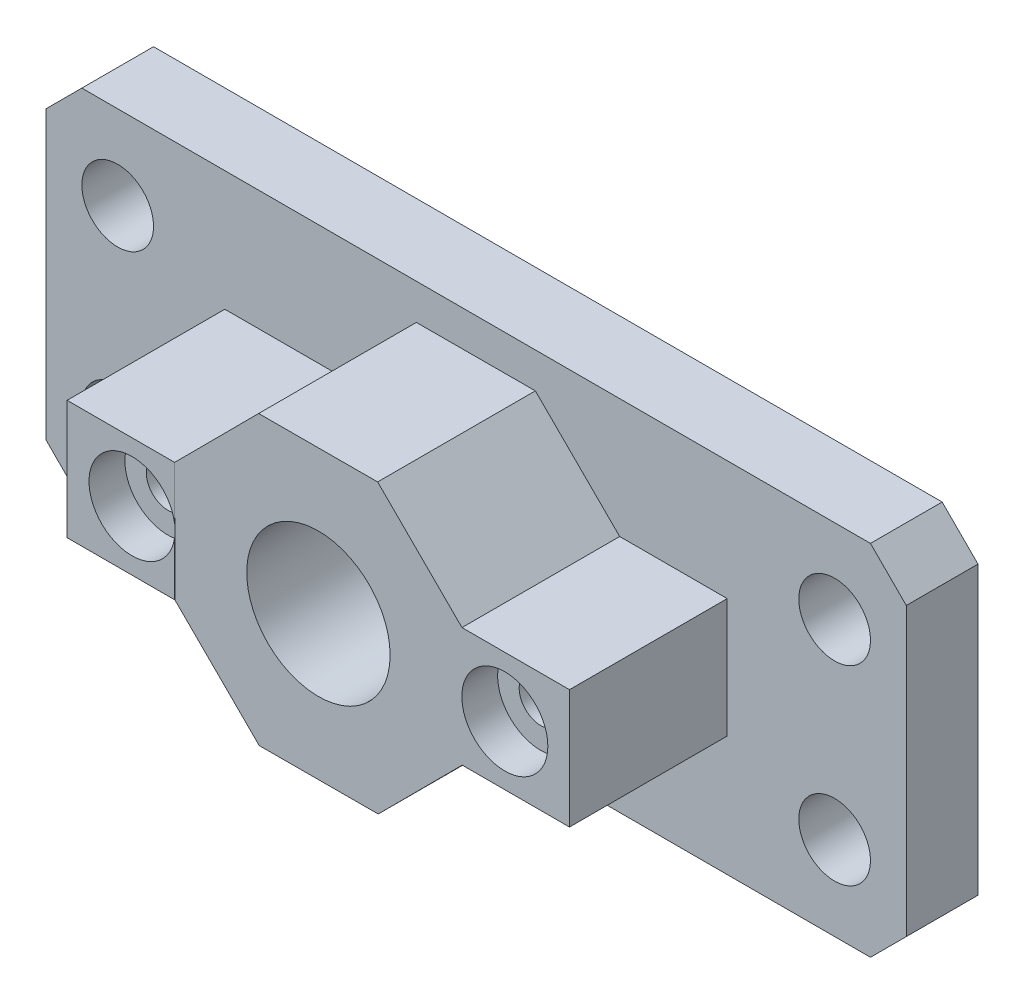
from build123d import *

# Parameters (mm, degrees)
SKETCH_1_W                 = 120
SKETCH_1_H                 = 50
EXTRUDE_1_DEPTH            = 10
CUT_EXTRUDE_START          = 10
SKETCH_1_4_R               = 5
CUT_EXTRUDE_1_DEPTH        = 76.76473219
SKETCH_1_5_R               = 5
CUT_EXTRUDE_2_DEPTH        = 76.76473219
SKETCH_1_6_R               = 5
CUT_EXTRUDE_3_DEPTH        = 76.76473219
SKETCH_1_7_R               = 5
CUT_EXTRUDE_4_DEPTH        = 76.76473219
EXTRUDE_START              = 10
EXTRUDE_2_DEPTH            = 22
SKETCH_1_9_W               = 15
SKETCH_1_9_H               = 16.6
EXTRUDE_7_DEPTH            = 22
SKETCH_1_10_W              = 15
SKETCH_1_10_H              = 16.6
EXTRUDE_8_DEPTH            = 22
CUT_EXTRUDE_START_2        = 32
SKETCH_1_11_R              = 10
CUT_EXTRUDE_5_DEPTH        = 22
HOLE_WIZARD_M52_AT_2_COUNT = 2
HOLE_WIZARD_M52_AT_2_PITCH = 52
CHAMFER_4_SIZE             = 5


with BuildPart() as part:
    # Эскиз1 → Бобышка-Вытянуть1 (new body)
    with BuildSketch(Plane.XY):
        Rectangle(SKETCH_1_W, SKETCH_1_H)
    extrude(amount=EXTRUDE_1_DEPTH)

    # Эскиз1<4> → Вырез-Вытянуть1 (cut, through all)
    with BuildSketch(Plane.XY.offset(CUT_EXTRUDE_START)):
        with Locations(Location((-50, 13.3, 0), (0, 0, 180))):
            Circle(SKETCH_1_4_R)
    extrude(amount=-CUT_EXTRUDE_1_DEPTH, mode=Mode.SUBTRACT)

    # Эскиз1<5> → Вырез-Вытянуть2 (cut, through all)
    with BuildSketch(Plane.XY.offset(CUT_EXTRUDE_START)):
        with Locations(Location((-50, -13.3, 0), (0, 0, 180))):
            Circle(SKETCH_1_5_R)
    extrude(amount=-CUT_EXTRUDE_2_DEPTH, mode=Mode.SUBTRACT)

    # Эскиз1<6> → Вырез-Вытянуть3 (cut, through all)
    with BuildSketch(Plane.XY.offset(CUT_EXTRUDE_START)):
        with Locations(Location((50, 13.3, 0), (0, 0, 180))):
            Circle(SKETCH_1_6_R)
    extrude(amount=-CUT_EXTRUDE_3_DEPTH, mode=Mode.SUBTRACT)

    # Эскиз1<7> → Вырез-Вытянуть4 (cut, through all)
    with BuildSketch(Plane.XY.offset(CUT_EXTRUDE_START)):
        with Locations(Location((50, -13.3, 0), (0, 0, 180))):
            Circle(SKETCH_1_7_R)
    extrude(amount=-CUT_EXTRUDE_4_DEPTH, mode=Mode.SUBTRACT)

    # Эскиз1<8> → Бобышка-Вытянуть2 (add)
    with BuildSketch(Plane.XY.offset(EXTRUDE_START)):
        Polygon((20.055336508, -8.258079739), (20.020608627, 8.341920261), (8.258079739, 20.055336508), (-8.341920261, 20.020608627), (-20.055336508, 8.258079739), (-20.020608627, -8.341920261), (-8.258079739, -20.055336508), (8.341920261, -20.020608627), align=None)
    extrude(amount=EXTRUDE_2_DEPTH)

    # Эскиз1<10> → Бобышка-Вытянуть8 (add)
    with BuildSketch(Plane.XY.offset(EXTRUDE_START)):
        with Locations((27.520608627, 0.041920261)):
            Rectangle(SKETCH_1_10_W, SKETCH_1_10_H)
    extrude(amount=EXTRUDE_8_DEPTH)

    # Эскиз1<11> → Вырез-Вытянуть5 (cut)
    with BuildSketch(Plane.XY.offset(CUT_EXTRUDE_START_2)):
        Circle(SKETCH_1_11_R)
    extrude(amount=-CUT_EXTRUDE_5_DEPTH, mode=Mode.SUBTRACT)


with BuildPart() as body_2:
    # Эскиз1<9> → Бобышка-Вытянуть7 (new body)
    with BuildSketch(Plane.XY.offset(EXTRUDE_START)):
        with Locations((-27.555336508, -0.041920261)):
            Rectangle(SKETCH_1_9_W, SKETCH_1_9_H)
    extrude(amount=EXTRUDE_7_DEPTH)


with BuildPart() as hole_wizard_m52_tool:
    # Эскиз11 → Цековка для  болта с шестигранной головкой M52 (revolve)
    with BuildSketch(Plane(origin=(-26, 0, 32), x_dir=(0, -1, 0), z_dir=(1, 0, 0))):
        Polygon((0, 0), (0, 25), (3, 25), (3, 5), (6, 5), (6, 0), align=None)
    hole_wizard_m52 = revolve(axis=Axis((-26, 0, 38.35), (0, 0, -1)))


with BuildPart() as part_1:
    add(part.part)

    # Цековка для  болта с шестигранной головкой M52: cut by hole_wizard_m52_tool
    add(hole_wizard_m52_tool.part, mode=Mode.SUBTRACT)

    # Цековка для  болта с шестигранной головкой M52 at 2: Цековка для  болта с шестигранной головкой M52 ×2
    with Locations(*[(i * HOLE_WIZARD_M52_AT_2_PITCH, 0, 0) for i in range(1, HOLE_WIZARD_M52_AT_2_COUNT)]):
        add(hole_wizard_m52, mode=Mode.SUBTRACT)

    # Фаска4
    chamfer_4_edges = [part_1.edges().sort_by_distance(p)[0] for p in [
        (-60, 25, 5),
        (-60, -25, 5),
        (60, -25, 5),
        (60, 25, 5),
    ]]
    chamfer(chamfer_4_edges, length=CHAMFER_4_SIZE)


with BuildPart() as body_2_1:
    add(body_2.part)

    # Цековка для  болта с шестигранной головкой M52: cut by hole_wizard_m52_tool
    add(hole_wizard_m52_tool.part, mode=Mode.SUBTRACT)


solid = Compound([part_1.part, body_2_1.part])
